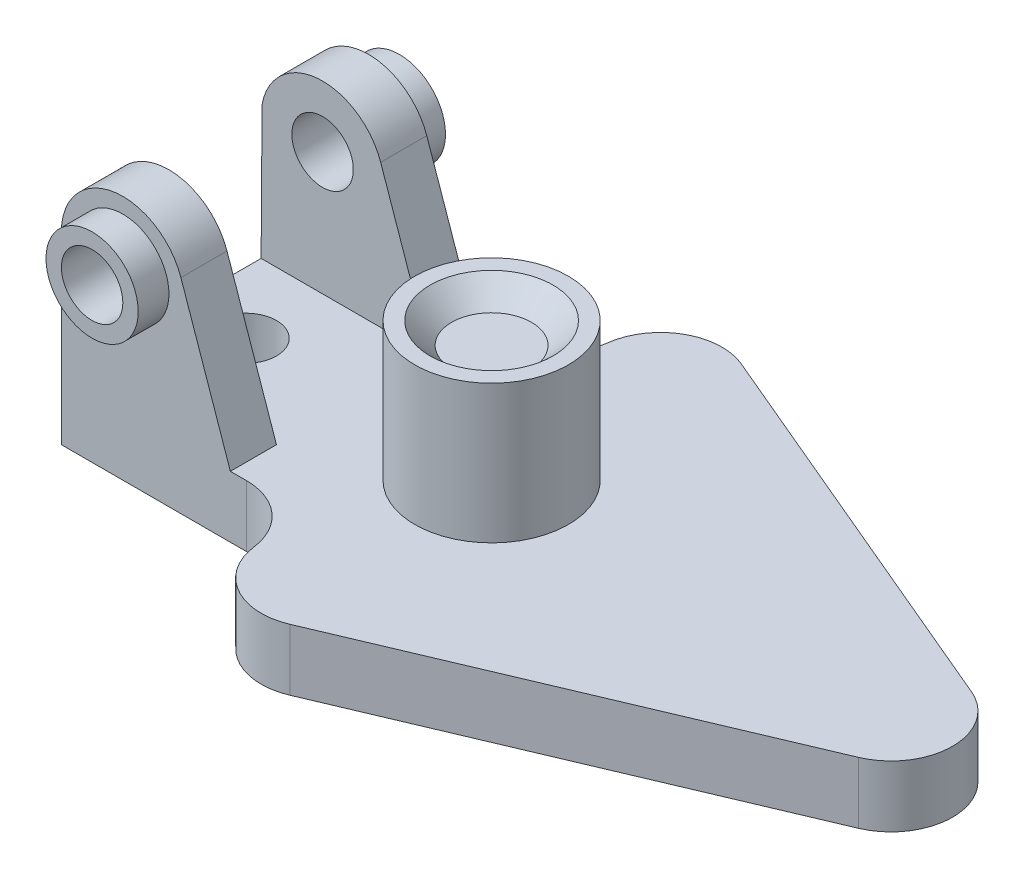
from build123d import *

# Parameters (mm, degrees)
SKETCH4_R           = 10
BOSS_EXTRUDE1_DEPTH = 20
SKETCH5_R           = 10
BOSS_EXTRUDE2_DEPTH = 15
BOSS_EXTRUDE4_START = 10
SKETCH6_R           = 15
SKETCH6_R_2         = 10
BOSS_EXTRUDE4_DEPTH = 10
BOSS_EXTRUDE6_START = -15
SKETCH10_R          = 10
BOSS_EXTRUDE6_DEPTH = 15
SKETCH11_R          = 15
SKETCH11_R_2        = 10
BOSS_EXTRUDE7_DEPTH = 10
SKETCH12_R          = 25
BOSS_EXTRUDE8_DEPTH = 45
SKETCH14_R          = 20
CUT_EXTRUDE3_DEPTH  = 7
CUT_EXTRUDE3_DRAFT  = -45


with BuildPart() as part:
    # Sketch4 → Boss-Extrude1 (new body)
    with BuildSketch(Plane(origin=(0, 0, 0), x_dir=(1, 0, 0), z_dir=(0, 1, 0))):
        with BuildLine():
            Line((-77.28011811, -56.673598022), (-77.28011811, 23.326401978))
            Line((-77.28011811, 23.326401978), (-16.966387776, 23.326401978))
            ThreePointArc((-16.966387776, 23.326401978), (-3.737631221, 28.326401978), (2.876747057, 40.826401978))
            ThreePointArc((2.876747057, 40.826401978), (12.736944948, 55.656750215), (30.512681706, 56.745747))
            Line((30.512681706, 56.745747), (160.512681706, 1.745747))
            ThreePointArc((160.512681706, 1.745747), (172.71988189, -16.673598022), (160.512681706, -35.092943043))
            Line((160.512681706, -35.092943043), (30.512681706, -90.092943043))
            ThreePointArc((30.512681706, -90.092943043), (12.736944948, -89.003946259), (2.876747057, -74.173598022))
            ThreePointArc((2.876747057, -74.173598022), (-3.737631221, -61.673598022), (-16.966387776, -56.673598022))
            Line((-16.966387776, -56.673598022), (-77.28011811, -56.673598022))
        make_face()
        with Locations((-57.28011811, -16.673598022)):
            Circle(SKETCH4_R, mode=Mode.SUBTRACT)
    extrude(amount=BOSS_EXTRUDE1_DEPTH)

    # Sketch5 → Boss-Extrude2 (add)
    with BuildSketch(Plane.XY.offset(56.673598022)):
        with BuildLine():
            Line((-77.28011811, 20), (-77.28011811, 60))
            ThreePointArc((-77.28011811, 60), (-60.595178298, 79.723345962), (-38.379080515, 66.538407896))
            Line((-38.379080515, 66.538407896), (-22.28011811, 20))
            Line((-22.28011811, 20), (-77.28011811, 20))
        make_face()
        with Locations((-57.28011811, 60)):
            Circle(SKETCH5_R, mode=Mode.SUBTRACT)
    extrude(amount=-BOSS_EXTRUDE2_DEPTH)

    # Sketch6 → Boss-Extrude4 (add)
    with BuildSketch(Plane.XY.offset(56.673598022).offset(BOSS_EXTRUDE4_START)):
        with Locations((-57.28011811, 60)):
            Circle(SKETCH6_R)
        with Locations((-57.28011811, 60)):
            Circle(SKETCH6_R_2, mode=Mode.SUBTRACT)
    extrude(amount=-BOSS_EXTRUDE4_DEPTH)

    # Sketch10 → Boss-Extrude6 (add)
    with BuildSketch(Plane(origin=(0, 0, -23.326401978), x_dir=(-1, 0, 0), z_dir=(0, 0, -1)).offset(BOSS_EXTRUDE6_START)):
        with BuildLine():
            Line((22.28011811, 20), (38.379080515, 66.538407896))
            ThreePointArc((38.379080515, 66.538407896), (58.842761472, 79.938860191), (76.96898439, 63.514049605))
            Line((76.96898439, 63.514049605), (77.28011811, 20))
            Line((77.28011811, 20), (22.28011811, 20))
        make_face()
        with Locations((57.28011811, 60)):
            Circle(SKETCH10_R, mode=Mode.SUBTRACT)
    extrude(amount=BOSS_EXTRUDE6_DEPTH)

    # Sketch11 → Boss-Extrude7 (add)
    with BuildSketch(Plane(origin=(0, 0, -23.326401978), x_dir=(-1, 0, 0), z_dir=(0, 0, -1))):
        with Locations((57.28011811, 60)):
            Circle(SKETCH11_R)
        with Locations((57.28011811, 60)):
            Circle(SKETCH11_R_2, mode=Mode.SUBTRACT)
    extrude(amount=BOSS_EXTRUDE7_DEPTH)

    # Sketch12 → Boss-Extrude8 (add)
    with BuildSketch(Plane(origin=(0, 20, 0), x_dir=(1, 0, 0), z_dir=(0, 1, 0))):
        with Locations((22.71988189, -16.673598022)):
            Circle(SKETCH12_R)
    extrude(amount=BOSS_EXTRUDE8_DEPTH)


with BuildPart() as cut_extrude3_tool:
    # Sketch14 → Cut-Extrude3 (with draft: the straight prism first)
    with BuildSketch(Plane(origin=(0, 65, 0), x_dir=(1, 0, 0), z_dir=(0, 1, 0))):
        with Locations((22.71988189, -16.673598022)):
            Circle(SKETCH14_R)
    extrude(amount=-CUT_EXTRUDE3_DEPTH)
    # Cut-Extrude3: the draft: its side faces are tilted about the plane it starts from
    cut_extrude3_sides = [cut_extrude3_tool.faces().sort_by_distance(p)[0] for p in [
        (2.71988189, 61.5, 16.673598022),
    ]]
    draft(cut_extrude3_sides, Plane(origin=(0, 65, 0), x_dir=(1, 0, 0), z_dir=(0, 1, 0)), CUT_EXTRUDE3_DRAFT)


with BuildPart() as part_1:
    add(part.part)

    # Cut-Extrude3: cut by cut_extrude3_tool
    add(cut_extrude3_tool.part, mode=Mode.SUBTRACT)


solid = part_1.part
